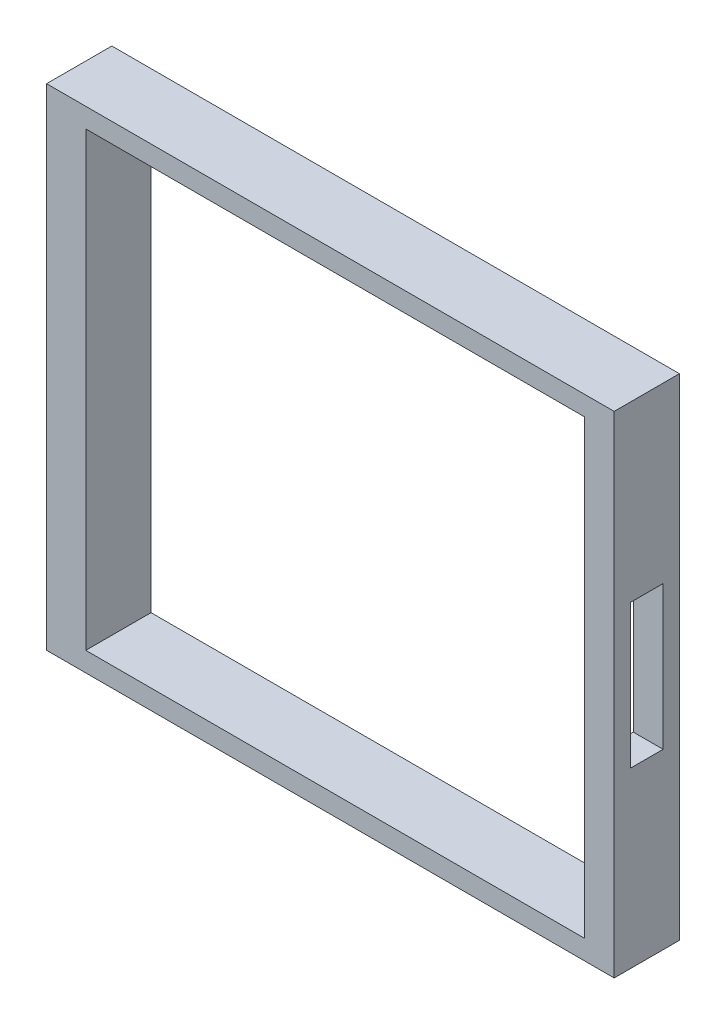
from build123d import *

# Parameters (mm, degrees)
SKETCH2_W           = 86.977379584
SKETCH2_H           = 75.2
SKETCH2_W_2         = 76.4
SKETCH2_H_2         = 69.2
BOSS_EXTRUDE2_DEPTH = 10
SKETCH3_W           = 5
SKETCH3_H           = 22
CUT_EXTRUDE1_DEPTH  = 5


with BuildPart() as part:
    # Sketch2 → Boss-Extrude2 (new body)
    with BuildSketch(Plane.XY):
        with Locations((2.910081101, -14.643371259)):
            Rectangle(SKETCH2_W, SKETCH2_H)
        with Locations((3.627163462, -14.643371259)):
            Rectangle(SKETCH2_W_2, SKETCH2_H_2, mode=Mode.SUBTRACT)
    extrude(amount=BOSS_EXTRUDE2_DEPTH)

    # Sketch3 → Cut-Extrude1 (cut)
    with BuildSketch(Plane(origin=(46.398770893, 0, 0), x_dir=(0, 0, -1), z_dir=(1, 0, 0))):
        with Locations((-5, -14.643371259)):
            Rectangle(SKETCH3_W, SKETCH3_H)
    extrude(amount=-CUT_EXTRUDE1_DEPTH, mode=Mode.SUBTRACT)


solid = part.part
